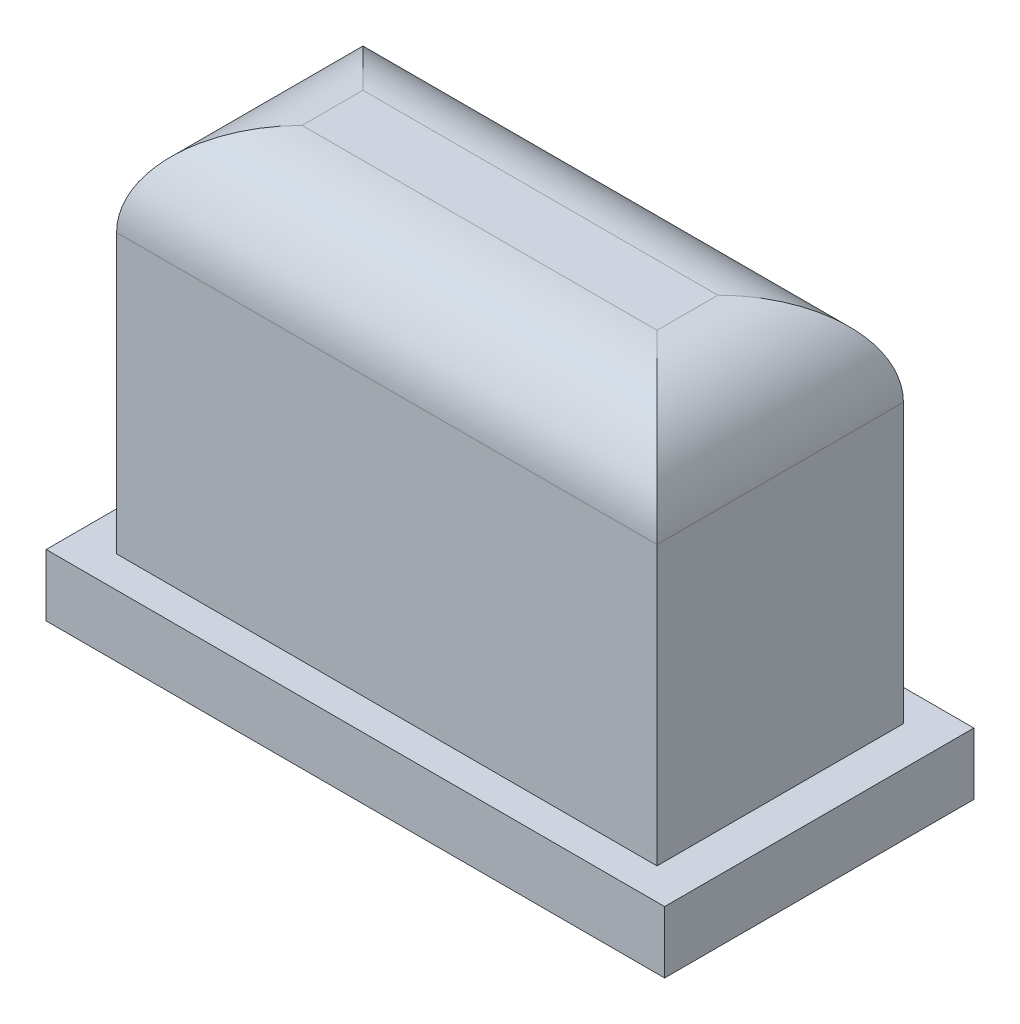
from build123d import *

# Parameters (mm, degrees)
CROQUIS1_W              = 100
CROQUIS1_H              = 50
SALIENTE_EXTRUIR1_DEPTH = 10
CROQUIS2_W              = 87.380374462
CROQUIS2_H              = 39.837581604
SALIENTE_EXTRUIR2_DEPTH = 60
REDONDEO1_R             = 15
CROQUIS3_R              = 6.082397519
SALIENTE_EXTRUIR3_DEPTH = 10


with BuildPart() as part:
    # Croquis1 → Saliente-Extruir1 (new body)
    with BuildSketch(Plane(origin=(0, 0, 0), x_dir=(1, 0, 0), z_dir=(0, 1, 0))):
        Rectangle(CROQUIS1_W, CROQUIS1_H)
    extrude(amount=SALIENTE_EXTRUIR1_DEPTH)

    # Croquis2 → Saliente-Extruir2 (add)
    with BuildSketch(Plane(origin=(0, 10, 0), x_dir=(1, 0, 0), z_dir=(0, 1, 0))):
        Rectangle(CROQUIS2_W, CROQUIS2_H)
    extrude(amount=SALIENTE_EXTRUIR2_DEPTH)

    # Redondeo1
    redondeo1_edges = [part.edges().sort_by_distance(p)[0] for p in [
        (-43.690187231, 70, 0),
        (0, 70, 19.918790802),
        (43.690187231, 70, 0),
        (0, 70, -19.918790802),
    ]]
    fillet(redondeo1_edges, radius=REDONDEO1_R)

    # Croquis3 → Saliente-Extruir3 (add)
    with BuildSketch(Plane.XZ):
        with Locations(Location((0, 0, 0), (0, 0, 270))):
            Circle(CROQUIS3_R)
    extrude(amount=SALIENTE_EXTRUIR3_DEPTH)


solid = part.part
